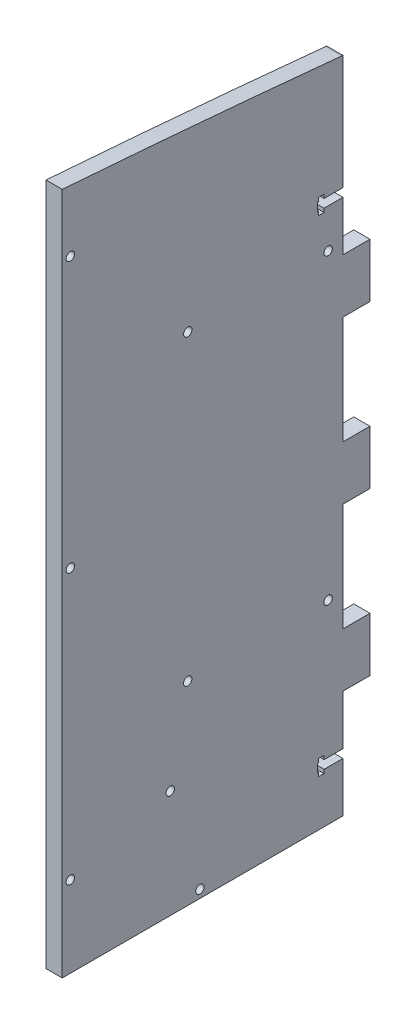
from build123d import *

# Parameters (mm, degrees)
DODANIE_WYCI_GNI_CIE1_DEPTH      = 108
DODANIE_WYCI_GNI_CIE1_DEPTH_BACK = 6
SZKIC1_W                         = 6
SZKIC1_H                         = 327
SZKIC2_W                         = 10
SZKIC2_H                         = 40
WYTNIJ_WYCI_GNI_CIE1_DEPTH       = 6
SZKIC7_R                         = 1.55
WYTNIJ_WYCI_GNI_CIE2_DEPTH       = 6
WYTNIJ_WYCI_GNI_CIE3_DEPTH       = 6
SZYK_LINIOWY1_COUNT              = 2
SZYK_LINIOWY1_PITCH              = 180
SZKIC9_W                         = 22
SZKIC9_H                         = 13
WYTNIJ_WYCI_GNI_CIE4_DEPTH       = 6
SZKIC11_R                        = 1.55
WYTNIJ_WYCI_GNI_CIE5_DEPTH       = 6
SZYK_LINIOWY2_COUNT              = 2
SZYK_LINIOWY2_PITCH              = 100
SZYK_LINIOWY2_COL_COUNT          = 2
SZYK_LINIOWY2_COL_PITCH          = 200
SZKIC14_R                        = 1.55
WYTNIJ_WYCI_GNI_CIE7_DEPTH       = 6
WYTNIJ_WYCI_GNI_CIE9_DEPTH       = 6


with BuildPart() as part:
    # Szkic1 → Dodanie-wyciągnięcie1 (new, two sides: drawn at the far end of the back side and taken through both)
    with BuildSketch(Plane.XY.offset(-DODANIE_WYCI_GNI_CIE1_DEPTH_BACK)):
        with Locations((-53, -253.103962956)):
            Rectangle(SZKIC1_W, SZKIC1_H)
    extrude(amount=DODANIE_WYCI_GNI_CIE1_DEPTH + DODANIE_WYCI_GNI_CIE1_DEPTH_BACK)

    # Szkic2 → Wytnij-wyciągnięcie1 (cut)
    with BuildSketch(Plane.ZY.offset(56)):
        with Locations((-1, -396.603962956)):
            Rectangle(SZKIC2_W, SZKIC2_H)
        with Locations((-1, -336.603962956)):
            Rectangle(SZKIC2_W, SZKIC2_H)
        Polygon((4, -176.603962956), (4, -42.619854706), (-6, -42.619854706), (-6, -176.603962956), (-6, -196.603962956), (-6, -236.603962956), (4, -236.603962956), (4, -196.603962956), align=None)
        with Locations((-1, -276.603962956)):
            Rectangle(SZKIC2_W, SZKIC2_H)
    extrude(amount=-WYTNIJ_WYCI_GNI_CIE1_DEPTH, mode=Mode.SUBTRACT)

    # Szkic7 → Wytnij-wyciągnięcie2 (cut)
    with BuildSketch(Plane.ZY.offset(56)):
        with Locations((57, -413.603962956)):
            Circle(SZKIC7_R)
    extrude(amount=-WYTNIJ_WYCI_GNI_CIE2_DEPTH, mode=Mode.SUBTRACT)

    # Szkic8 → Wytnij-wyciągnięcie3 (cut)
    with BuildSketch(Plane.ZY.offset(56)):
        Polygon((4, -395.053962956), (11, -395.053962956), (11, -393.678962956), (13, -393.678962956), (13, -395.053962956), (13.5, -395.053962956), (13.5, -398.153962956), (13, -398.153962956), (13, -399.528962956), (11, -399.528962956), (11, -398.153962956), (4, -398.153962956), align=None)
    wytnij_wyci_gni_cie3 = extrude(amount=-WYTNIJ_WYCI_GNI_CIE3_DEPTH, mode=Mode.SUBTRACT)

    # Szyk liniowy1: Wytnij-wyciągnięcie3 ×2
    with Locations(*[(0, i * SZYK_LINIOWY1_PITCH, 0) for i in range(1, SZYK_LINIOWY1_COUNT)]):
        add(wytnij_wyci_gni_cie3, mode=Mode.SUBTRACT)

    # Szkic9 → Wytnij-wyciągnięcie4 (cut)
    with BuildSketch(Plane.ZY.offset(56)):
        with Locations((65, -96.103962956)):
            Rectangle(SZKIC9_W, SZKIC9_H)
    extrude(amount=-WYTNIJ_WYCI_GNI_CIE4_DEPTH, mode=Mode.SUBTRACT)

    # Szkic11 → Wytnij-wyciągnięcie5 (cut)
    with BuildSketch(Plane.ZY.offset(56)):
        with Locations(Location((105, -386.603962956, 0), (0, 0, 270))):
            Circle(SZKIC11_R)
    wytnij_wyci_gni_cie5 = extrude(amount=-WYTNIJ_WYCI_GNI_CIE5_DEPTH, mode=Mode.SUBTRACT)

    # Szyk liniowy2: Wytnij-wyciągnięcie5 ×2
    with Locations(*[(0, i * SZYK_LINIOWY2_PITCH, 0) for i in range(1, SZYK_LINIOWY2_COUNT)]):
        add(wytnij_wyci_gni_cie5, mode=Mode.SUBTRACT)

    # Szyk liniowy2 col: Wytnij-wyciągnięcie5 ×2
    with Locations(*[(0, i * SZYK_LINIOWY2_COL_PITCH, 0) for i in range(1, SZYK_LINIOWY2_COL_COUNT)]):
        add(wytnij_wyci_gni_cie5, mode=Mode.SUBTRACT)

    # Szkic14 → Wytnij-wyciągnięcie7 (cut)
    with BuildSketch(Plane(origin=(-50, 0, 0), x_dir=(0, 0, -1), z_dir=(1, 0, 0))):
        with Locations(Location((-68, -376.603962956, 0), (0, 0, 90))):
            Circle(SZKIC14_R)
        with Locations(Location((-9.5, -232.603962956, 0), (0, 0, 90))):
            Circle(SZKIC14_R)
        with Locations(Location((-61.5, -232.603962956, 0), (0, 0, 90))):
            Circle(SZKIC14_R)
        with Locations(Location((-61.5, -344.603962956, 0), (0, 0, 90))):
            Circle(SZKIC14_R)
        with Locations(Location((-9.5, -344.603962956, 0), (0, 0, 90))):
            Circle(SZKIC14_R)
    extrude(amount=-WYTNIJ_WYCI_GNI_CIE7_DEPTH, mode=Mode.SUBTRACT)

    # Szkic15 → Wytnij-wyciągnięcie9 (cut)
    with BuildSketch(Plane.ZY.offset(56)):
        with BuildLine():
            Line((4, -172.624757885), (4, -89.603962956))
            Line((4, -89.603962956), (54, -89.603962956))
            Line((54, -89.603962956), (54, -102.603962956))
            Line((54, -102.603962956), (76, -102.603962956))
            Line((76, -102.603962956), (76, -89.603962956))
            Line((76, -89.603962956), (108, -89.603962956))
            Line((108, -89.603962956), (108, -163.601221201))
            ThreePointArc((108, -163.601221201), (56.219772668, -167.781476219), (4.492818283, -172.576125802))
            Line((4.492818283, -172.576125802), (4, -172.624757885))
        make_face()
    extrude(amount=-WYTNIJ_WYCI_GNI_CIE9_DEPTH, mode=Mode.SUBTRACT)


solid = part.part
